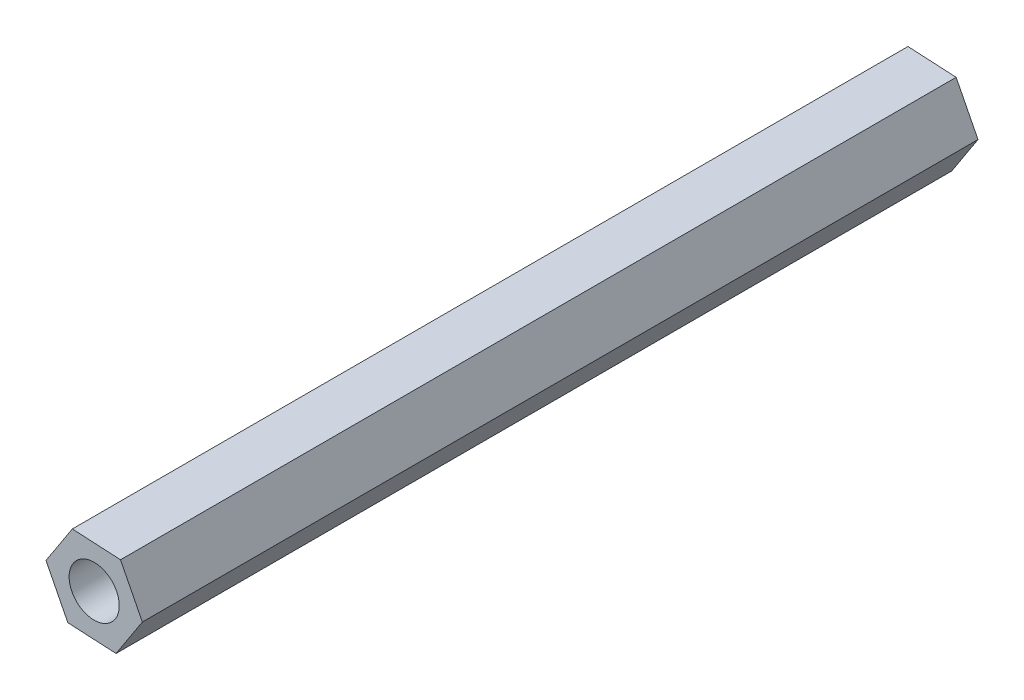
from build123d import *

# Parameters (mm, degrees)
BOSS_EXTRUDE1_DEPTH = 50
SKETCH2_R           = 1.5
CUT_EXTRUDE1_DEPTH  = 51.149118307


with BuildPart() as part:
    # Sketch1 → Boss-Extrude1 (new body)
    with BuildSketch(Plane.XY):
        Polygon((1.57545706, 2.418939517), (-1.307134542, 2.573855595), (-2.882591602, 0.154916078), (-1.57545706, -2.418939517), (1.307134542, -2.573855595), (2.882591602, -0.154916078), align=None)
    extrude(amount=BOSS_EXTRUDE1_DEPTH)

    # Sketch2 → Cut-Extrude1 (cut, through all)
    with BuildSketch(Plane(origin=(0, 0, 0), x_dir=(-1, 0, 0), z_dir=(0, 0, -1))):
        Circle(SKETCH2_R)
    extrude(amount=-CUT_EXTRUDE1_DEPTH, mode=Mode.SUBTRACT)


solid = part.part
